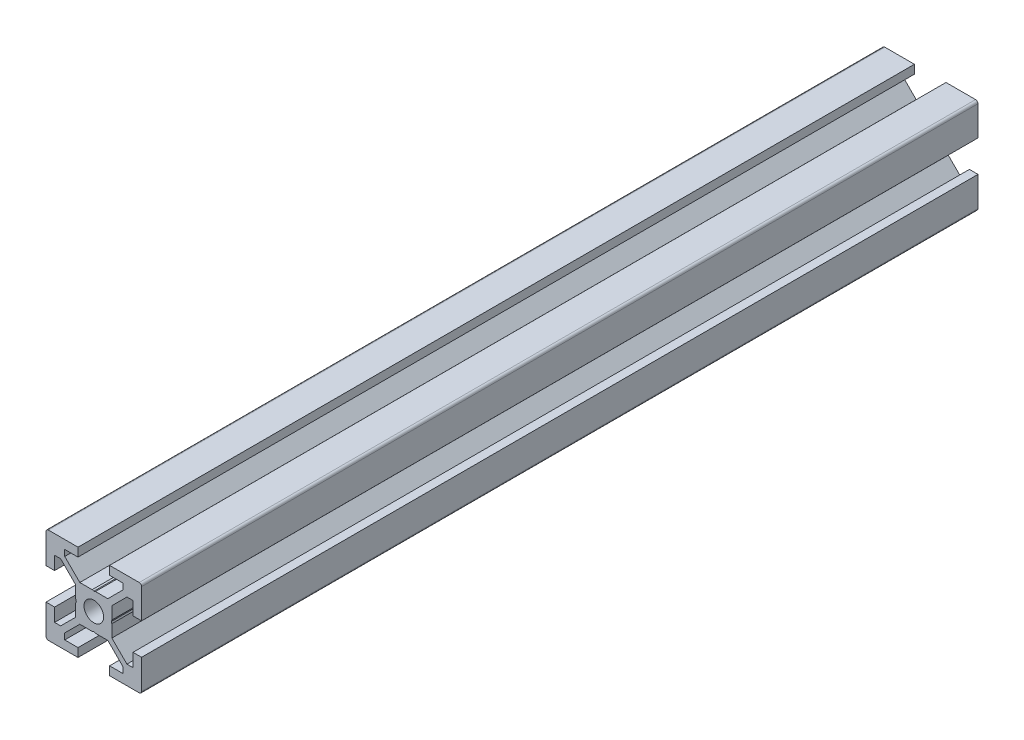
from build123d import *

# Parameters (mm, degrees)
SKETCH1_R           = 2.05
BOSS_EXTRUDE1_DEPTH = 175
FILLET1_R           = 0.5


with BuildPart() as part:
    # Sketch1 → Boss-Extrude1 (new body)
    with BuildSketch(Plane.XY):
        Polygon((-3.3, 10), (-3.3, 8.2), (-6.08, 8.2), (-6.08, 6.928528137), (-2.931471863, 3.78), (-0.34, 3.78), (0, 3.66), (0.34, 3.78), (2.931471863, 3.78), (6.08, 6.928528137), (6.08, 8.2), (3.3, 8.2), (3.3, 10), (10, 10), (10, 3.3), (8.2, 3.3), (8.2, 6.08), (6.928528137, 6.08), (3.78, 2.931471863), (3.78, 0.34), (3.66, 0), (3.78, -0.34), (3.78, -2.931471863), (6.928528137, -6.08), (8.2, -6.08), (8.2, -3.3), (10, -3.3), (10, -10), (3.3, -10), (3.3, -8.2), (6.08, -8.2), (6.08, -6.928528137), (2.931471863, -3.78), (0.34, -3.78), (0, -3.66), (-0.34, -3.78), (-2.931471863, -3.78), (-6.08, -6.928528137), (-6.08, -8.2), (-3.3, -8.2), (-3.3, -10), (-10, -10), (-10, -3.3), (-8.2, -3.3), (-8.2, -6.08), (-6.928528137, -6.08), (-3.78, -2.931471863), (-3.78, -0.34), (-3.66, 0), (-3.78, 0.34), (-3.78, 2.931471863), (-6.928528137, 6.08), (-8.2, 6.08), (-8.2, 3.3), (-10, 3.3), (-10, 10), align=None)
        Circle(SKETCH1_R, mode=Mode.SUBTRACT)
    extrude(amount=BOSS_EXTRUDE1_DEPTH)

    # Fillet1
    fillet1_edges = [part.edges().sort_by_distance(p)[0] for p in [
        (10, 10, 87.5),
        (10, -10, 87.5),
        (-10, -10, 87.5),
        (-10, 10, 87.5),
    ]]
    fillet(fillet1_edges, radius=FILLET1_R)


solid = part.part
